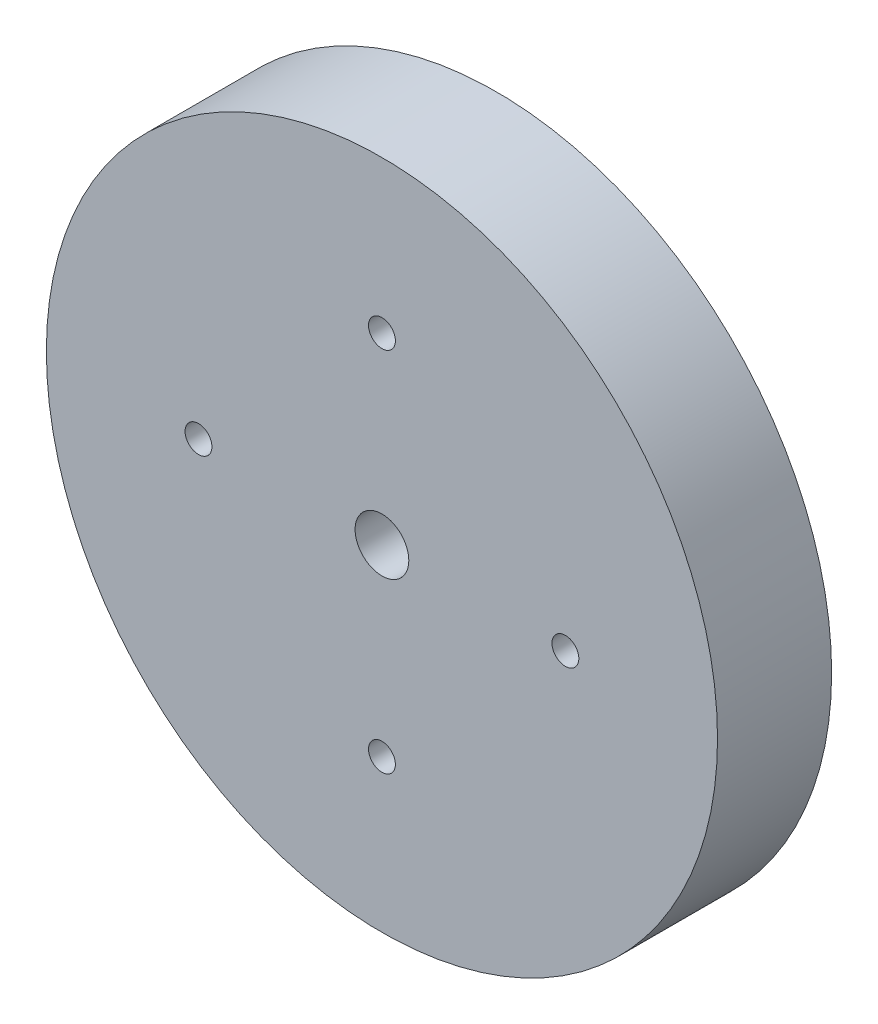
from build123d import *

# Parameters (mm, degrees)
SKETCH1_R           = 19.05
SKETCH1_R_2         = 1.524
SKETCH1_R_3         = 0.762
BOSS_EXTRUDE1_DEPTH = 6.477


with BuildPart() as part:
    # Sketch1 → Boss-Extrude1 (new body)
    with BuildSketch(Plane.XY):
        Circle(SKETCH1_R)
        Circle(SKETCH1_R_2, mode=Mode.SUBTRACT)
        with Locations((10.414, 0)):
            Circle(SKETCH1_R_3, mode=Mode.SUBTRACT)
        with Locations((-10.414, 0)):
            Circle(SKETCH1_R_3, mode=Mode.SUBTRACT)
        with Locations((0, 10.414)):
            Circle(SKETCH1_R_3, mode=Mode.SUBTRACT)
        with Locations((0, -10.414)):
            Circle(SKETCH1_R_3, mode=Mode.SUBTRACT)
    extrude(amount=BOSS_EXTRUDE1_DEPTH)


solid = part.part
